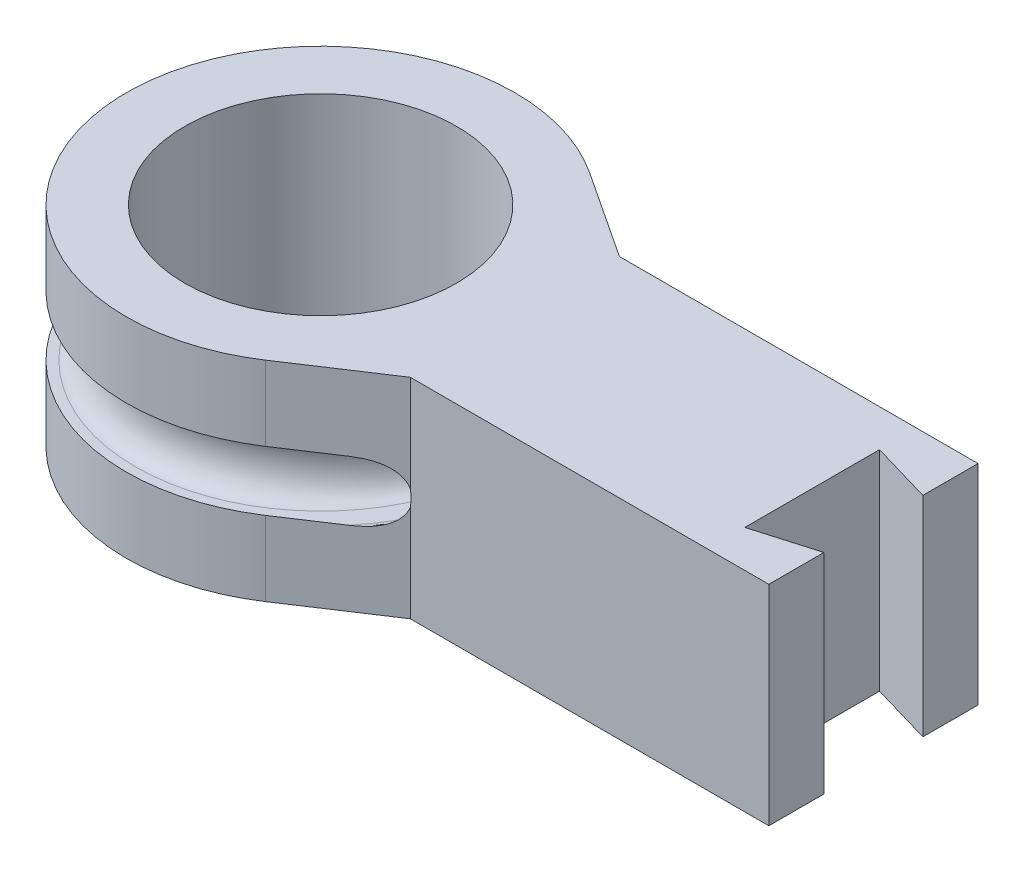
from build123d import *

# Parameters (mm, degrees)
SKETCH1_R           = 4.55
BOSS_EXTRUDE2_DEPTH = 7


with BuildPart() as part:
    # Sketch1 → Boss-Extrude2 (new body)
    with BuildSketch(Plane(origin=(0, 0, 0), x_dir=(1, 0, 0), z_dir=(0, 1, 0))):
        with BuildLine():
            Line((6.5, 3.5), (3.577981651, 5.426605505))
            ThreePointArc((3.577981651, 5.426605505), (-6.5, 0), (3.577981651, -5.426605505))
            Line((3.577981651, -5.426605505), (6.5, -3.5))
            Line((6.5, -3.5), (18.5, -3.5))
            Line((18.5, -3.5), (18.5, -1.655))
            Line((18.5, -1.655), (16.45, -2.255))
            Line((16.45, -2.255), (16.45, 2.255))
            Line((16.45, 2.255), (18.5, 1.655))
            Line((18.5, 1.655), (18.5, 3.5))
            Line((18.5, 3.5), (6.5, 3.5))
        make_face()
        with Locations(Location((0, 0, 0), (0, 0, 270))):
            Circle(SKETCH1_R, mode=Mode.SUBTRACT)
    extrude(amount=BOSS_EXTRUDE2_DEPTH)

    # Sketch2 → Cut-Revolve1 (revolve, cut)
    with BuildSketch(Plane(origin=(0, 0, 0), x_dir=(0, -1, 0), z_dir=(1, 0, 0))):
        with BuildLine():
            Line((-4.5, 6.805), (-4.5, 6.195))
            add(Edge.make_bspline(
                [(-4.5, 6.195), (-4.5, 5.595), (-3.5, 5.595), (-2.5, 5.595), (-2.5, 6.195)],
                knots=[0, 0, 0, 1.570796327, 1.570796327, 3.141592654, 3.141592654, 3.141592654], degree=2, weights=[1, 0.707106781, 1, 0.707106781, 1]))
            Line((-2.5, 6.195), (-2.5, 6.805))
            add(Edge.make_bspline(
                [(-2.5, 6.805), (-2.499999858, 7.405000085), (-3.5, 7.405000085), (-4.500000142, 7.405000085), (-4.5, 6.805)],
                knots=[3.141592512, 3.141592512, 3.141592512, 4.71238898, 4.71238898, 6.283185449, 6.283185449, 6.283185449], degree=2, weights=[1, 0.707106731, 1, 0.707106731, 1]))
        make_face()
    revolve(axis=Axis((0, 7.335318457, 0), (0, -1, 0)), mode=Mode.SUBTRACT)


solid = part.part
